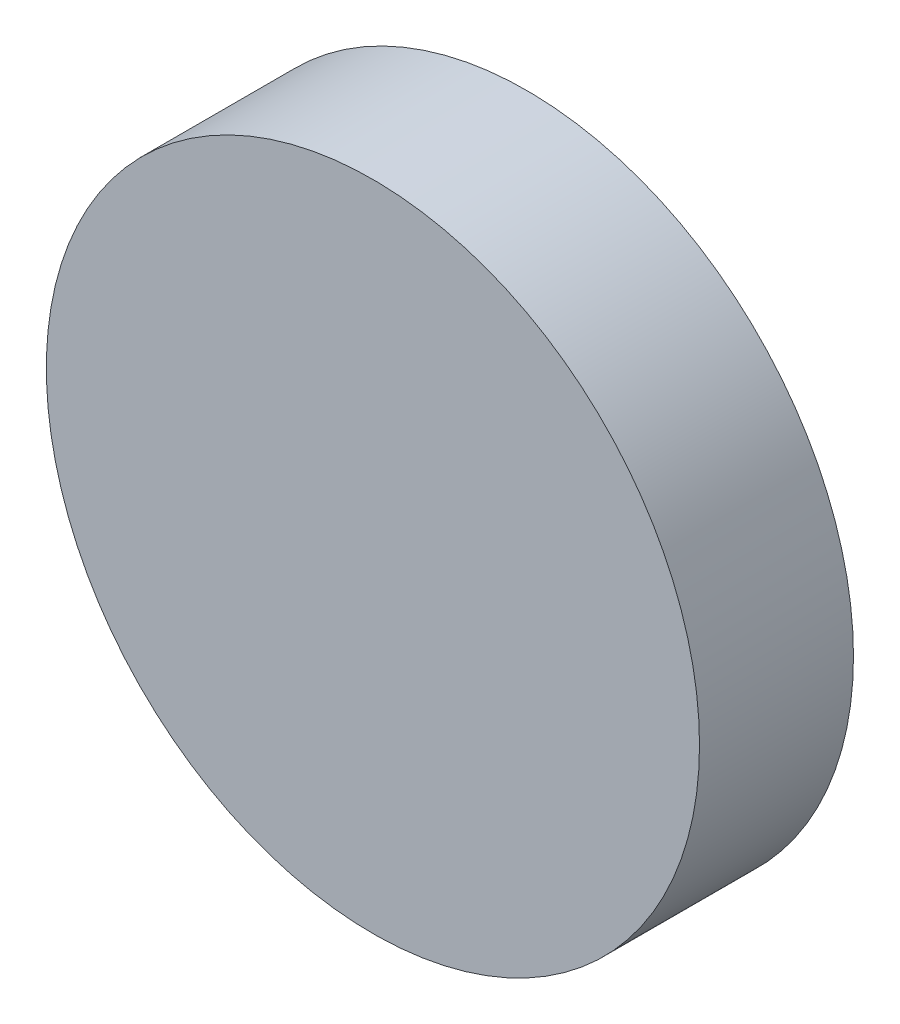
from build123d import *

# Parameters (mm, degrees)
SKETCH1_R           = 70
BOSS_EXTRUDE1_DEPTH = 33


with BuildPart() as part:
    # Sketch1 → Boss-Extrude1 (new body)
    with BuildSketch(Plane.XY):
        Circle(SKETCH1_R)
    extrude(amount=BOSS_EXTRUDE1_DEPTH)


solid = part.part
